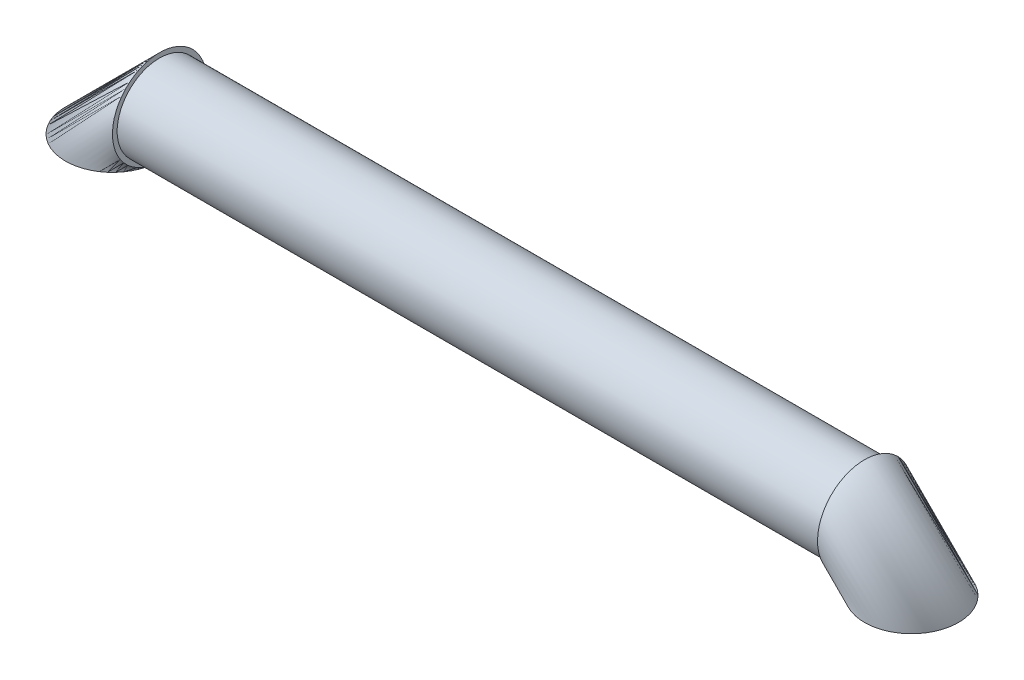
from build123d import *

# Parameters (mm, degrees)
SKETCH2_R           = 50
SKETCH5_R           = 50
BOSS_EXTRUDE1_DEPTH = 750
SKETCH6_R           = 50
SKETCH6_R_2         = 45
CUT_EXTRUDE1_DEPTH  = 750


with BuildPart() as part:
    # Sweep1: sweep along a path in Sketch4
    with BuildLine(Plane.XY) as sweep1_path:
        ThreePointArc((0, 0), (14.644660941, 35.355339059), (50, 50))
    # Sketch2 → Sweep1 (sweep)
    with BuildSketch(Plane(origin=(0, 0, 0), x_dir=(1, 0, 0), z_dir=(0, 1, 0))):
        Circle(SKETCH2_R)
    sweep1 = sweep(path=sweep1_path.line)

    # Sketch5 → Boss-Extrude1 (add)
    with BuildSketch(Plane(origin=(50, 0, 0), x_dir=(0, 0, -1), z_dir=(1, 0, 0))):
        with Locations(Location((0, 50, 0), (0, 0, 270))):
            Circle(SKETCH5_R)
    extrude(amount=BOSS_EXTRUDE1_DEPTH)

    # Mirror1: Sweep1 across plane
    add(sweep1.mirror(Plane(origin=(425, 0, 0), x_dir=(0, 0, 1), z_dir=(1, 0, 0))))

    # Sketch6 → Cut-Extrude1 (cut)
    with BuildSketch(Plane(origin=(50, 0, 0), x_dir=(0, 0, -1), z_dir=(1, 0, 0))):
        with Locations((0, 50)):
            Circle(SKETCH6_R)
        with Locations((0, 50)):
            Circle(SKETCH6_R_2, mode=Mode.SUBTRACT)
    extrude(amount=CUT_EXTRUDE1_DEPTH, mode=Mode.SUBTRACT)


solid = part.part
